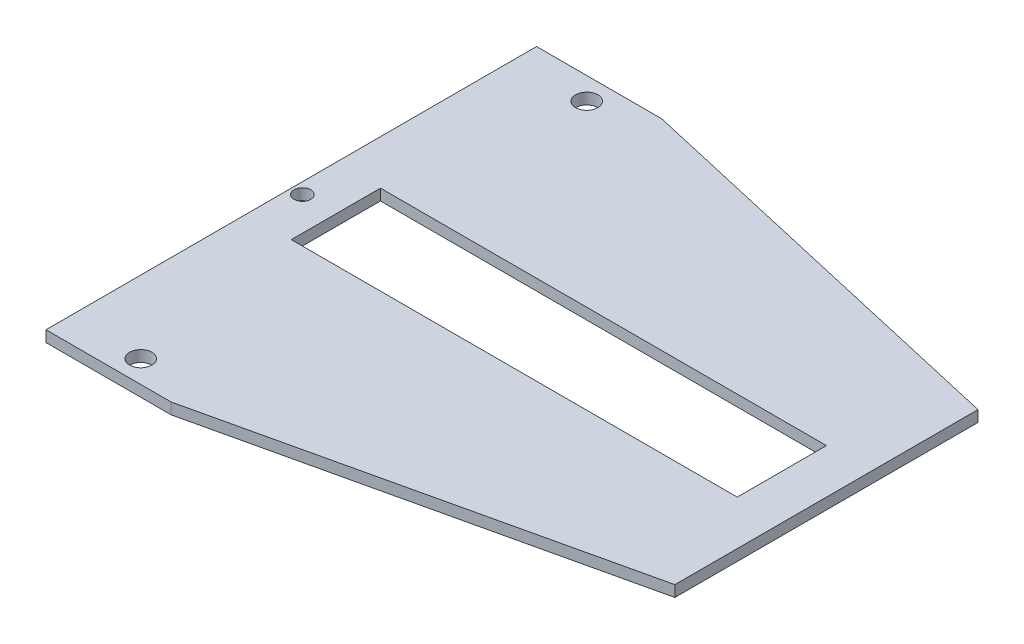
from build123d import *

# Parameters (mm, degrees)
SKETCH1_R           = 6.35
SKETCH1_R_2         = 4.7625
BOSS_EXTRUDE1_DEPTH = 6.35


with BuildPart() as part:
    # Sketch1 → Boss-Extrude1 (new body)
    with BuildSketch(Plane(origin=(0, 0, 0), x_dir=(1, 0, 0), z_dir=(0, 1, 0))):
        Polygon((0, -86.324674442), (0, -139.7), (71.282950652, -139.7), (304.8, -86.324674442), (304.8, 86.324674442), (71.282950652, 139.7), (0, 139.7), (0, 86.324674442), (0, 6.35), (0, -6.35), align=None)
        with Locations(Location((41.27321438, -127, 0), (0, 0, 270))):
            Circle(SKETCH1_R, mode=Mode.SUBTRACT)
        with Locations(Location((41.27321438, 127, 0), (0, 0, 90))):
            Circle(SKETCH1_R, mode=Mode.SUBTRACT)
        with Locations(Location((6.34821438, 0, 0), (0, 0, 270))):
            Circle(SKETCH1_R_2, mode=Mode.SUBTRACT)
        Polygon((279.4, 25.4), (279.4, -25.4), (25.4, -25.4), (25.4, -6.35), (25.4, 6.35), (25.4, 25.4), align=None, mode=Mode.SUBTRACT)
    extrude(amount=BOSS_EXTRUDE1_DEPTH)


solid = part.part
